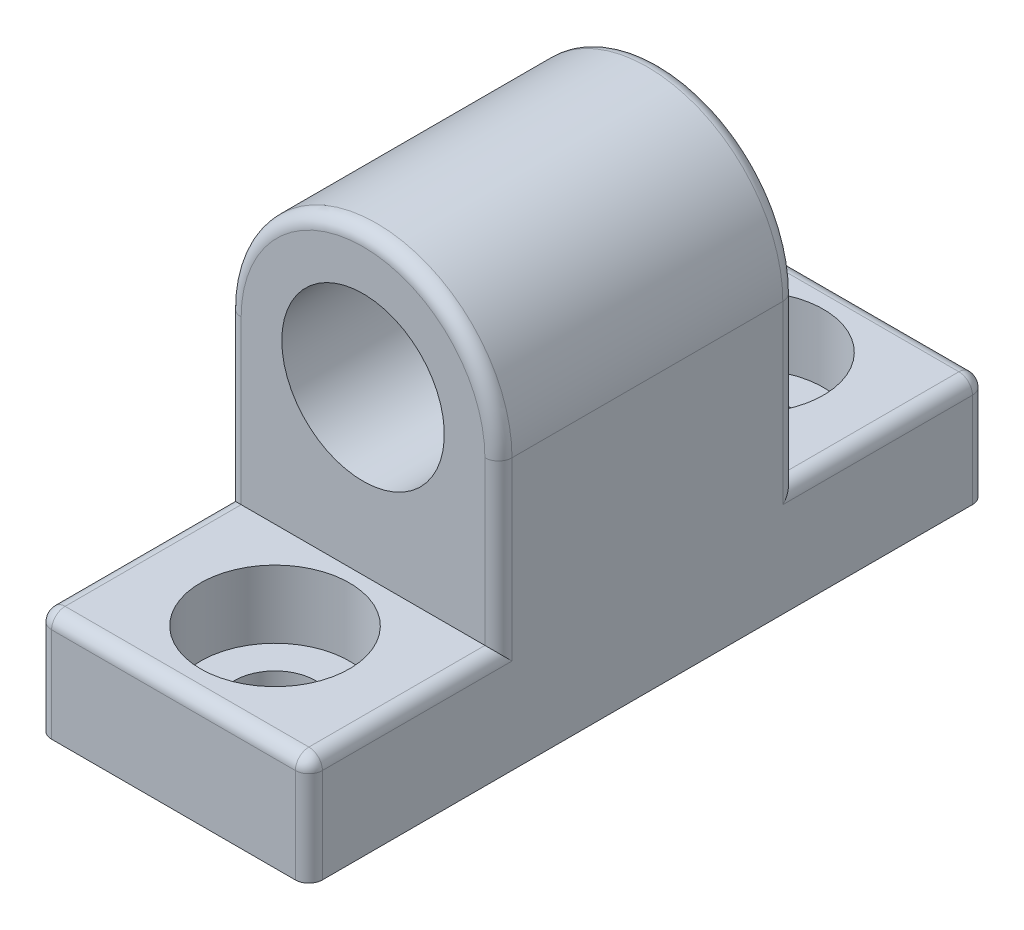
from build123d import *

# Parameters (mm, degrees)
SKETCH_1_R               = 6
EXTRUDE_1_DEPTH          = 25
CUT_EXTRUDE_1_DEPTH      = 41.311288741
CUT_EXTRUDE_1_DEPTH_BACK = 41.311288741
SKETCH_2_W               = 21.902921801
SKETCH_2_H               = 31.191688498
SKETCH_2_W_2             = 23.513880173
SKETCH_2_H_2             = 33.775615356
CUT_EXTRUDE_2_REACH      = 45.875
CUT_EXTRUDE_2_END_RADIUS = 6
SKETCH_3_R               = 2.5
SKETCH_4_R               = 3
CUT_EXTRUDE_3_DEPTH      = 12
SKETCH_5_R               = 5.5
CUT_EXTRUDE_4_DEPTH      = 5
SKETCH_6_R               = 3
CUT_EXTRUDE_5_DEPTH      = 39.131352027
FILLET_1_R               = 1


with BuildPart() as part:
    # Эскиз1 → Бобышка-Вытянуть1 (new, symmetric)
    with BuildSketch(Plane.XY):
        with BuildLine():
            Line((-10, 0), (10, 0))
            Line((10, 0), (10, 20))
            ThreePointArc((10, 20), (0, 30), (-10, 20))
            Line((-10, 20), (-10, 0))
        make_face()
        with Locations((0, 20)):
            Circle(SKETCH_1_R, mode=Mode.SUBTRACT)
    extrude(amount=EXTRUDE_1_DEPTH, both=True)

    # Эскиз2 → Вырез-Вытянуть1 (cut, two sides: drawn at the far end of the back side and taken through both)
    with BuildSketch(Plane(origin=(0, 0, 0), x_dir=(0, 0, -1), z_dir=(1, 0, 0)).offset(-CUT_EXTRUDE_1_DEPTH_BACK)):
        with Locations((21.951460901, 23.595844249)):
            Rectangle(SKETCH_2_W, SKETCH_2_H)
        with Locations((-22.756940087, 24.887807678)):
            Rectangle(SKETCH_2_W_2, SKETCH_2_H_2)
    extrude(amount=CUT_EXTRUDE_1_DEPTH + CUT_EXTRUDE_1_DEPTH_BACK, mode=Mode.SUBTRACT)

    # Вырез-Вытянуть2: up to this cylinder (the profile starts outside it)
    cut_extrude_2_end = Plane(origin=(0, 20, 0), z_dir=(0, 0, -1)) * Cylinder(CUT_EXTRUDE_2_END_RADIUS, 104.75, mode=Mode.PRIVATE)
    # Эскиз3 → Вырез-Вытянуть2 (cut, up to the surface)
    with BuildSketch(Plane.ZY.offset(10), mode=Mode.PRIVATE) as cut_extrude_2_sk1:
        with Locations((0, 20)):
            Circle(SKETCH_3_R)
    cut_extrude_2_tool1 = extrude(cut_extrude_2_sk1.sketch, amount=-CUT_EXTRUDE_2_REACH, mode=Mode.PRIVATE) - cut_extrude_2_end
    add(cut_extrude_2_tool1.solids().sort_by_distance((-10, 20, 0))[0], mode=Mode.SUBTRACT)

    # Эскиз4 → Вырез-Вытянуть3 (cut)
    with BuildSketch(Plane(origin=(0, 0, 0), x_dir=(-1, 0, 0), z_dir=(0, -1, 0))):
        with Locations(Location((0, 0, 0), (0, 0, 90))):
            Circle(SKETCH_4_R)
    extrude(amount=-CUT_EXTRUDE_3_DEPTH, mode=Mode.SUBTRACT)

    # Эскиз5 → Вырез-Вытянуть4 (cut)
    with BuildSketch(Plane(origin=(0, 8, 0), x_dir=(1, 0, 0), z_dir=(0, 1, 0))):
        with Locations(Location((0, 17.5, 0), (0, 0, 270))):
            Circle(SKETCH_5_R)
        with Locations(Location((0, -17.5, 0), (0, 0, 270))):
            Circle(SKETCH_5_R)
    extrude(amount=-CUT_EXTRUDE_4_DEPTH, mode=Mode.SUBTRACT)

    # Эскиз6 → Вырез-Вытянуть5 (cut, through all)
    with BuildSketch(Plane(origin=(0, 3, 0), x_dir=(1, 0, 0), z_dir=(0, 1, 0))):
        with Locations(Location((0, 17.5, 0), (0, 0, 270))):
            Circle(SKETCH_6_R)
        with Locations(Location((0, -17.5, 0), (0, 0, 270))):
            Circle(SKETCH_6_R)
    extrude(amount=-CUT_EXTRUDE_5_DEPTH, mode=Mode.SUBTRACT)

    # Скругление1
    fillet_1_edges = [part.edges().sort_by_distance(p)[0] for p in [
        (10, 4, 25),
        (-10, 4, -25),
        (-10, 4, 25),
        (-10, 8, -18),
        (0, 8, -25),
        (10, 8, -18),
        (10, 14, -11),
        (0, 30, -11),
        (-10, 14, -11),
        (0, 8, 25),
        (-10, 14, 11),
        (0, 30, 11),
        (-10, 8, 18),
        (10, 8, 18),
        (10, 14, 11),
        (10, 4, -25),
    ]]
    fillet(fillet_1_edges, radius=FILLET_1_R)


solid = part.part
